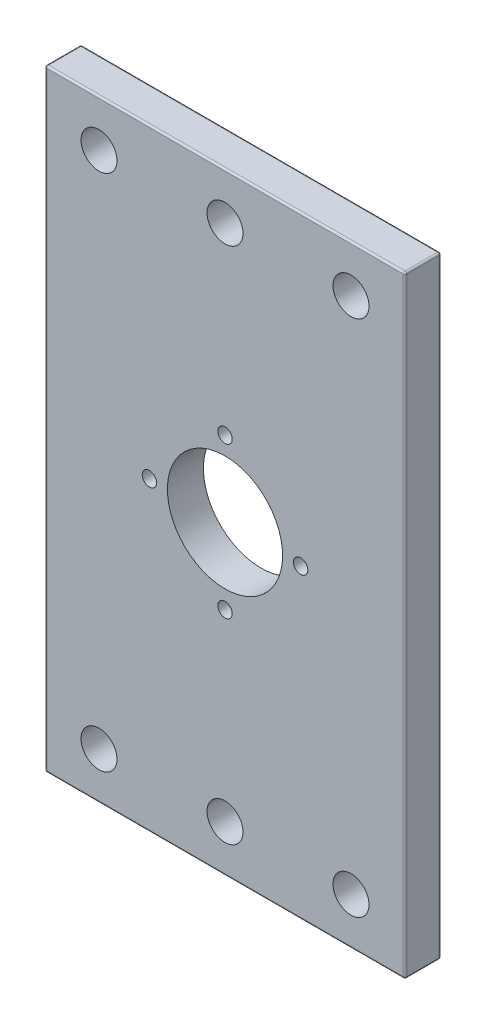
from build123d import *

# Parameters (mm, degrees)
EXTRUDE_1_DEPTH          = 10
SKETCH_2_R               = 16
CUT_EXTRUDE_1_DEPTH      = 10
SKETCH_3_R               = 5
CUT_EXTRUDE_2_DEPTH      = 10
SKETCH_6_R               = 2
CUT_EXTRUDE_4_DEPTH      = 10
PATTERN_CIRCULAR_1_COUNT = 4
FILLET_1_R               = 0.5


with BuildPart() as part:
    # 草图1 → 凸台-拉伸1 (new body)
    with BuildSketch(Plane.XY):
        Polygon((50, -85), (-50, -85), (-50, -20), (-50, 85), (50, 85), (50, 0), align=None)
    extrude(amount=EXTRUDE_1_DEPTH)

    # 草图2 → 切除-拉伸1 (cut)
    with BuildSketch(Plane.XY.offset(10)):
        Circle(SKETCH_2_R)
    extrude(amount=-CUT_EXTRUDE_1_DEPTH, mode=Mode.SUBTRACT)

    # 草图3 → 切除-拉伸2 (cut)
    with BuildSketch(Plane.XY.offset(10)):
        with Locations((0, -72)):
            Circle(SKETCH_3_R)
        with Locations((35, -72)):
            Circle(SKETCH_3_R)
        with Locations((-35, -72)):
            Circle(SKETCH_3_R)
    cut_extrude_2 = extrude(amount=-CUT_EXTRUDE_2_DEPTH, mode=Mode.SUBTRACT)

    # 草图6 → 切除-拉伸4 (cut)
    with BuildSketch(Plane.XY.offset(10)):
        with Locations((0, 21)):
            Circle(SKETCH_6_R)
    cut_extrude_4 = extrude(amount=-CUT_EXTRUDE_4_DEPTH, mode=Mode.SUBTRACT)

    # 阵列(圆周)1: 切除-拉伸4 ×4 about axis
    pattern_circular_1_axis = Axis((0, 0, 0), (0, 0, 1))
    for i in range(1, PATTERN_CIRCULAR_1_COUNT):
        add(cut_extrude_4.rotate(pattern_circular_1_axis, i * 360 / PATTERN_CIRCULAR_1_COUNT), mode=Mode.SUBTRACT)

    # 镜向1: 切除-拉伸2 across plane
    add(cut_extrude_2.mirror(Plane.ZX), mode=Mode.SUBTRACT)

    # 圆角1
    fillet_1_edges = [part.edges().sort_by_distance(p)[0] for p in [
        (50, -85, 5),
        (-50, -85, 5),
        (-50, 85, 5),
        (50, 85, 5),
        (-50, 0, 10),
        (0, -85, 10),
        (50, 0, 10),
        (50, 0, 0),
        (0, -85, 0),
        (-50, 0, 0),
        (0, 85, 0),
        (0, 85, 10),
    ]]
    fillet(fillet_1_edges, radius=FILLET_1_R)


solid = part.part
